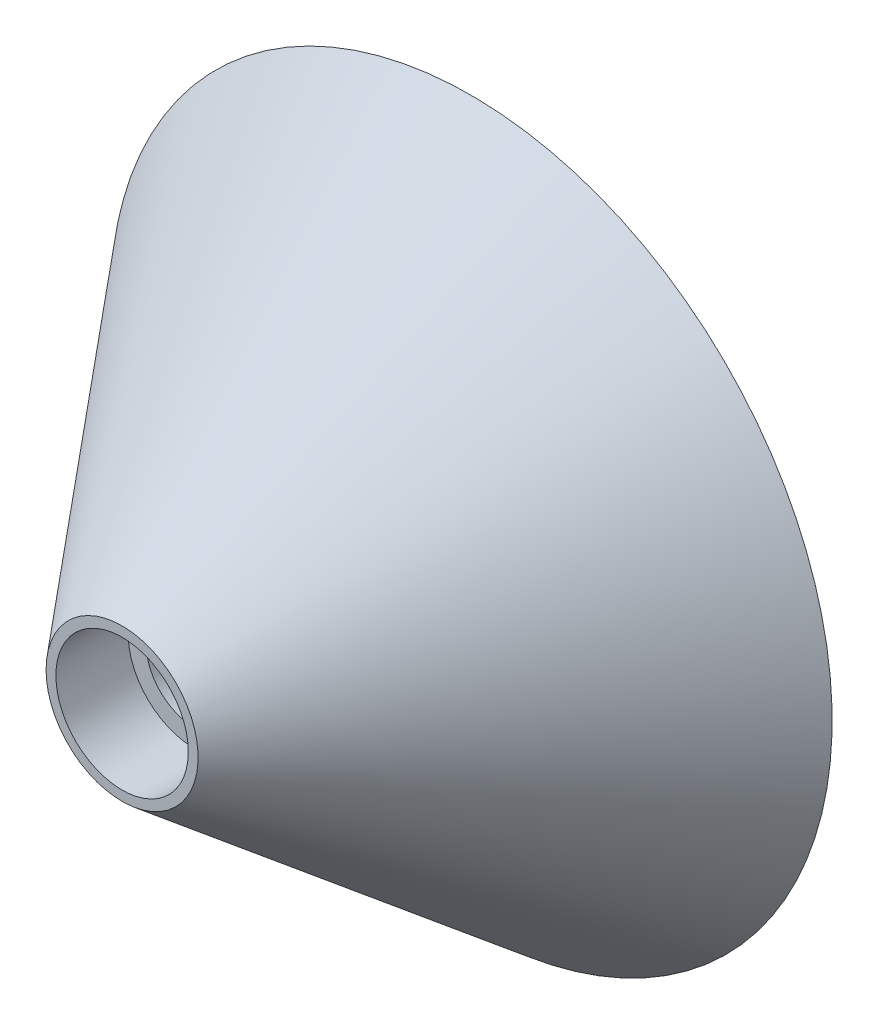
from build123d import *


with BuildPart() as part:
    # Skica1 → Rotovat1 (revolve)
    with BuildSketch(Plane(origin=(0, 0, 0), x_dir=(0, 0, -1), z_dir=(1, 0, 0)), mode=Mode.PRIVATE) as rotovat1_sk:
        Polygon((1.288336748, 5.5), (7.288336748, 5.5), (7.288336748, 4), (24.288262464, 4), (24.288262464, 5.5), (30.288262464, 5.5), (30.288262464, 30), (1.288336748, 6.316727332), align=None)
    revolve(rotovat1_sk.sketch.rotate(Axis((0, 0, 59.95975236), (0, 0, -1)), 90), axis=Axis((0, 0, 59.95975236), (0, 0, -1)))


solid = part.part
